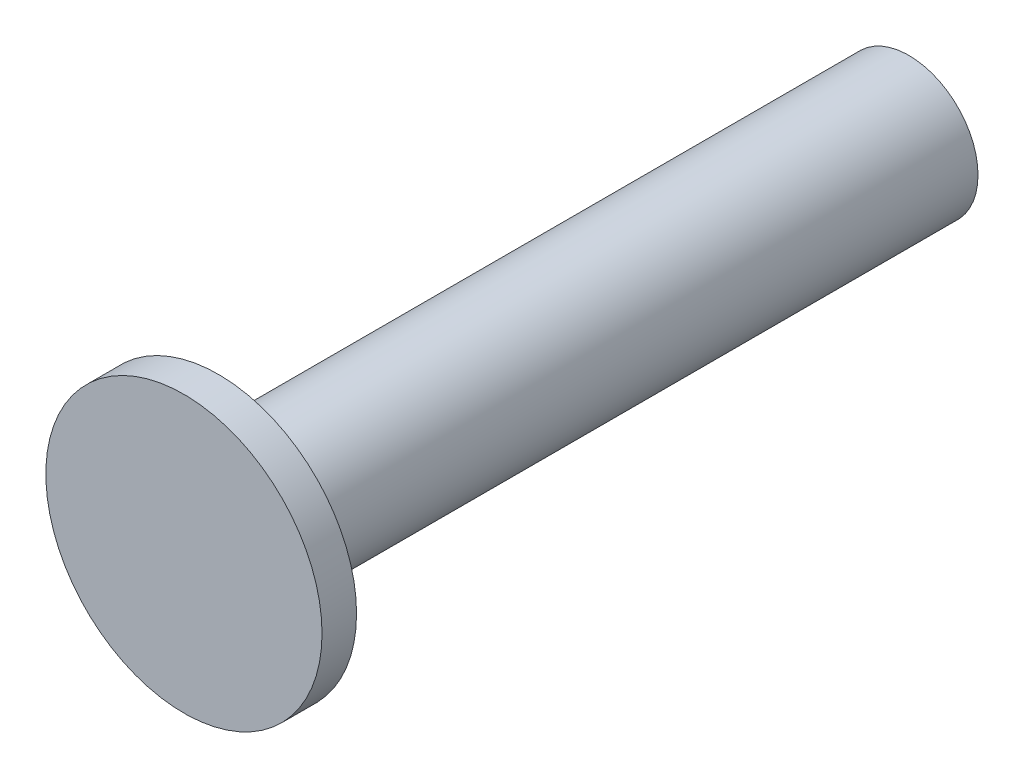
from build123d import *

# Parameters (mm, degrees)
SKETCH1_R           = 2
BOSS_EXTRUDE1_DEPTH = 20
SKETCH2_R           = 4
BOSS_EXTRUDE2_DEPTH = 1


with BuildPart() as part:
    # Sketch1 → Boss-Extrude1 (new body)
    with BuildSketch(Plane.XY):
        Circle(SKETCH1_R)
    extrude(amount=BOSS_EXTRUDE1_DEPTH)

    # Sketch2 → Boss-Extrude2 (add)
    with BuildSketch(Plane.XY.offset(20)):
        Circle(SKETCH2_R)
    extrude(amount=BOSS_EXTRUDE2_DEPTH)


solid = part.part
